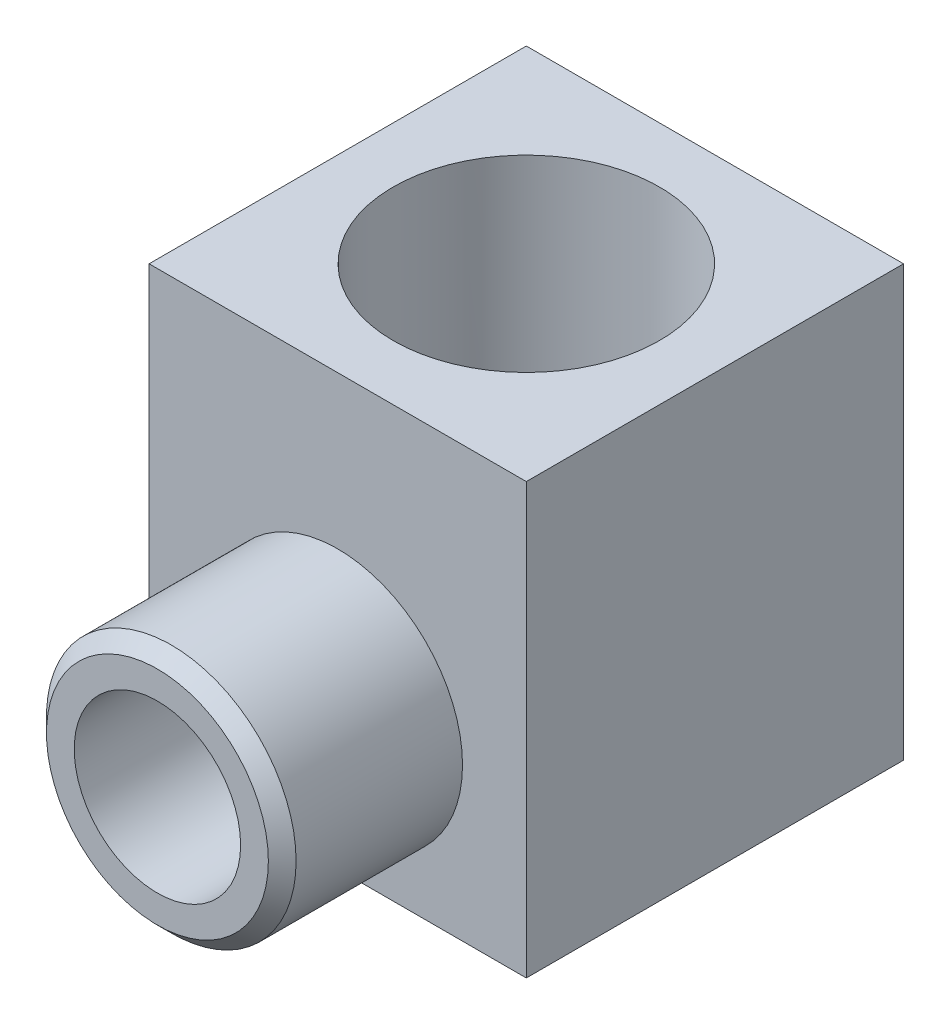
from build123d import *

# Parameters (mm, degrees)
SKETCH1_R           = 12.8
BOSS_EXTRUDE1_DEPTH = 20.1
SKETCH2_OUTSIDE_W   = 35.882
SKETCH2_OUTSIDE_H   = 35.882
SKETCH2_OUTSIDE_R   = 4.5
CUT_EXTRUDE1_DEPTH  = 6.5
CHAMFER1_SIZE       = 0.5
SKETCH3_R           = 3
CUT_EXTRUDE2_DEPTH  = 10
SKETCH4_OUTSIDE_W   = 35.882
SKETCH4_OUTSIDE_H   = 35.882
SKETCH4_OUTSIDE_W_2 = 13.6
SKETCH4_OUTSIDE_H_2 = 15.5
CUT_EXTRUDE3_DEPTH  = 13.6
SKETCH5_R           = 4.8
CUT_EXTRUDE4_DEPTH  = 13.5


with BuildPart() as part:
    # Sketch1 → Boss-Extrude1 (new body)
    with BuildSketch(Plane.XY):
        with Locations(Location((0, 0, 0), (0, 0, 180))):
            Circle(SKETCH1_R)
    extrude(amount=BOSS_EXTRUDE1_DEPTH)

    # Sketch2 outside → Cut-Extrude1 (cut)
    with BuildSketch(Plane.XY.offset(20.1)):
        Rectangle(SKETCH2_OUTSIDE_W, SKETCH2_OUTSIDE_H)
        Circle(SKETCH2_OUTSIDE_R, mode=Mode.SUBTRACT)
    extrude(amount=-CUT_EXTRUDE1_DEPTH, mode=Mode.SUBTRACT)

    # Chamfer1
    chamfer1_edges = [part.edges().sort_by_distance(p)[0] for p in [
        (-4.5, 0, 20.1),
    ]]
    chamfer(chamfer1_edges, length=CHAMFER1_SIZE)

    # Sketch3 → Cut-Extrude2 (cut)
    with BuildSketch(Plane.XY.offset(20.1)):
        Circle(SKETCH3_R)
    extrude(amount=-CUT_EXTRUDE2_DEPTH, mode=Mode.SUBTRACT)

    # Sketch4 outside → Cut-Extrude3 (cut)
    with BuildSketch(Plane.XY.offset(13.6)):
        Rectangle(SKETCH4_OUTSIDE_W, SKETCH4_OUTSIDE_H)
        with Locations((0, 2.25)):
            Rectangle(SKETCH4_OUTSIDE_W_2, SKETCH4_OUTSIDE_H_2, mode=Mode.SUBTRACT)
    extrude(amount=-CUT_EXTRUDE3_DEPTH, mode=Mode.SUBTRACT)

    # Sketch5 → Cut-Extrude4 (cut)
    with BuildSketch(Plane(origin=(0, 10, 0), x_dir=(1, 0, 0), z_dir=(0, 1, 0))):
        with Locations(Location((0, -6.8, 0), (0, 0, 270))):
            Circle(SKETCH5_R)
    extrude(amount=-CUT_EXTRUDE4_DEPTH, mode=Mode.SUBTRACT)


solid = part.part
